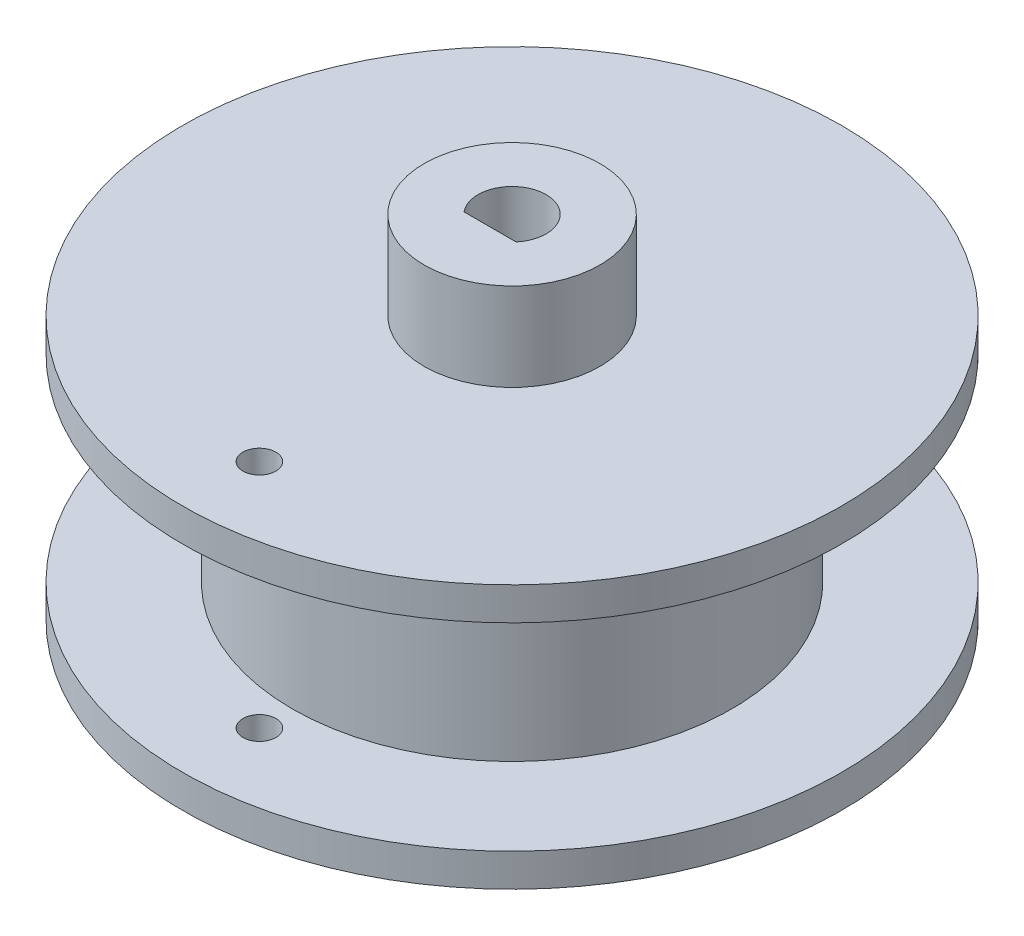
from build123d import *

# Parameters (mm, degrees)
SKETCH2_R           = 4
BOSS_EXTRUDE1_DEPTH = 4
CUT_EXTRUDE1_DEPTH  = 16
SKETCH4_R           = 0.75
CUT_EXTRUDE2_DEPTH  = 16


with BuildPart() as part:
    # Sketch1 → Revolve1 (revolve)
    with BuildSketch(Plane.XY, mode=Mode.PRIVATE) as revolve1_sk:
        Polygon((0, 0), (0, 12), (15, 12), (15, 10.5), (10, 10.5), (10, 1.5), (15, 1.5), (15, 0), align=None)
    revolve(revolve1_sk.sketch.rotate(Axis((0, 0, 0), (0, 1, 0)), 90), axis=Axis((0, 0, 0), (0, 1, 0)))

    # Sketch2 → Boss-Extrude1 (add)
    with BuildSketch(Plane(origin=(0, 12, 0), x_dir=(1, 0, 0), z_dir=(0, 1, 0))):
        with Locations(Location((0, 0, 0), (0, 0, 270))):
            Circle(SKETCH2_R)
    extrude(amount=BOSS_EXTRUDE1_DEPTH)

    # Sketch3 → Cut-Extrude1 (cut)
    with BuildSketch(Plane.XZ):
        with BuildLine():
            Line((-1.184271928, 1), (1.184271928, 1))
            ThreePointArc((1.184271928, 1), (0, -1.55), (-1.184271928, 1))
        make_face()
    extrude(amount=-CUT_EXTRUDE1_DEPTH, mode=Mode.SUBTRACT)

    # Sketch4 → Cut-Extrude2 (cut)
    with BuildSketch(Plane.XZ):
        with Locations(Location((0, 11.5, 0), (0, 0, 270))):
            Circle(SKETCH4_R)
    extrude(amount=-CUT_EXTRUDE2_DEPTH, mode=Mode.SUBTRACT)


solid = part.part
